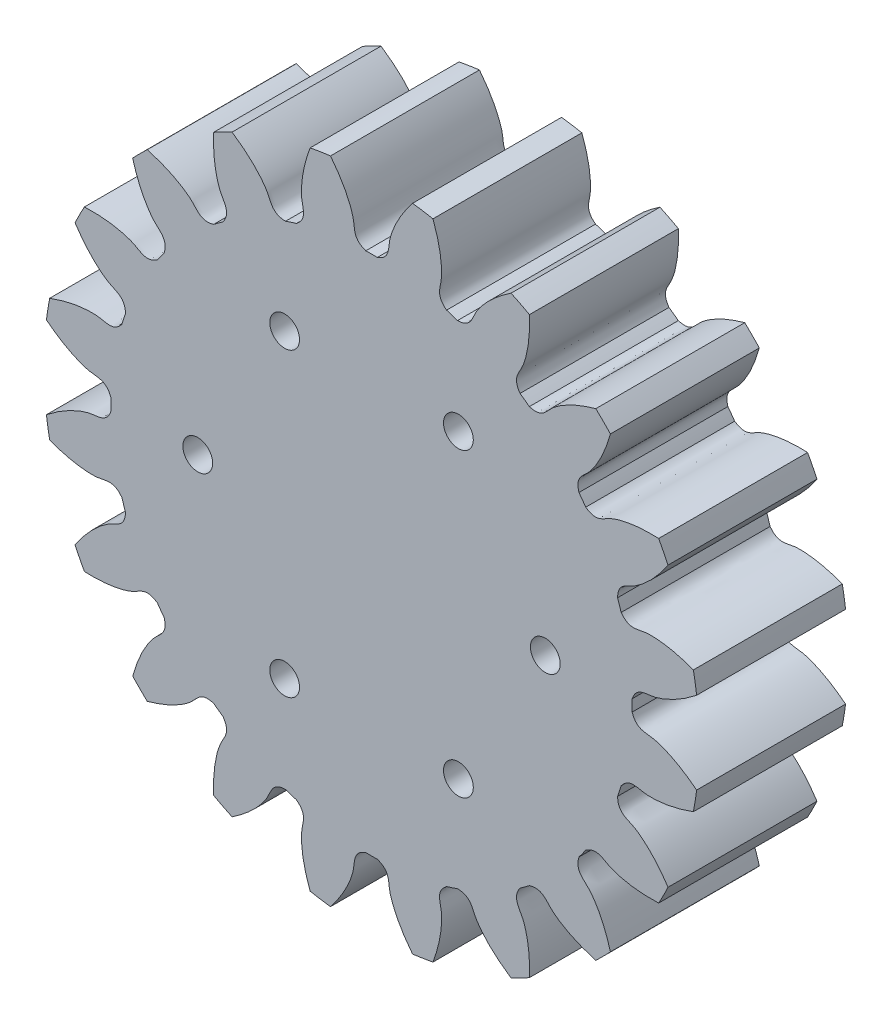
from build123d import *

# Parameters (mm, degrees)
SKETCH_1_R               = 66
EXTRUDE_1_DEPTH          = 30
CUT_EXTRUDE_1_DEPTH      = 99.04080783
PATTERN_CIRCULAR_1_COUNT = 20
SKETCH_4_R               = 3
CUT_EXTRUDE_3_DEPTH      = 100


with BuildPart() as part:
    # 草图1 → 凸台-拉伸1 (new body)
    with BuildSketch(Plane.XY):
        Circle(SKETCH_1_R)
    extrude(amount=EXTRUDE_1_DEPTH)

    # 草图2 → 切除-拉伸1 (cut, through all)
    with BuildSketch(Plane.XY):
        with BuildLine():
            ThreePointArc((1.159899603, 52.487185416), (0, 52.5), (-1.159899603, 52.487185416))
            add(Edge.make_bspline(
                [(-1.159899603, 52.487185416), (-3.667136429, 53.360853072), (-3.342504596, 55.122682193), (-3.677382338, 56.820056415), (-3.713353118, 56.985339684), (-3.757865339, 57.171807691), (-3.811752582, 57.379181016), (-3.875874841, 57.607148981), (-3.95107233, 57.855376968), (-4.038179229, 58.123504398), (-4.138018499, 58.411145682), (-4.251402599, 58.717890271), (-4.379132391, 59.043303003), (-4.521996613, 59.386924384), (-4.680771188, 59.748270908), (-4.856218588, 60.126835389), (-5.049087201, 60.522087305), (-5.260110701, 60.933473168), (-5.49000743, 61.360416899), (-5.739479794, 61.802320224), (-6.009213656, 62.258563085), (-6.299877757, 62.728504067), (-6.612123129, 63.211480832), (-6.946582534, 63.706810582), (-7.303869906, 64.213790522), (-7.684579804, 64.731698343), (-8.089286883, 65.259792724), (-8.51854537, 65.797313836), (-8.972888558, 66.343483869), (-9.452828311, 66.897507567), (-9.958854579, 67.458572777), (-10.491434933, 68.02585101), (-11.051014106, 68.598498015), (-11.638013557, 69.175654361), (-12.252831039, 69.756446037), (-12.895840191, 70.339985054), (-13.567390137, 70.925370065), (-14.26780511, 71.511686996), (-14.99738407, 72.098009677), (-15.756400406, 72.68340049), (-16.545101397, 73.266911041), (-17.648841545, 74.049839206), (-18.503594475, 74.617995606), (-19.086947891, 74.989511158)],
                knots=[0, 0, 0, 0, 0.165916003, 0.170905922, 0.176663519, 0.183188797, 0.190481754, 0.198542391, 0.207370708, 0.216966704, 0.22733038, 0.238461736, 0.250360771, 0.263027487, 0.276461881, 0.290663956, 0.30563371, 0.321371144, 0.337876258, 0.355149051, 0.373189524, 0.391997677, 0.411573509, 0.431917021, 0.453028213, 0.474907084, 0.497553636, 0.520967867, 0.545149777, 0.570099367, 0.595816637, 0.622301587, 0.649554216, 0.677574526, 0.706362514, 0.735918183, 0.766241531, 0.797332559, 0.829191267, 0.861817654, 0.895211721, 0.929373468, 1, 1, 1, 1], degree=3))
            ThreePointArc((-19.086947891, 74.989511158), (0, 77.380477922), (19.086947891, 74.989511158))
            add(Edge.make_bspline(
                [(1.159899603, 52.487185416), (3.667136429, 53.360853072), (3.342504596, 55.122682193), (3.677382338, 56.820056415), (3.713353118, 56.985339684), (3.757865339, 57.171807691), (3.811752582, 57.379181016), (3.875874841, 57.607148981), (3.95107233, 57.855376968), (4.038179229, 58.123504398), (4.138018499, 58.411145682), (4.251402599, 58.717890271), (4.379132391, 59.043303003), (4.521996613, 59.386924384), (4.680771188, 59.748270908), (4.856218588, 60.126835389), (5.049087201, 60.522087305), (5.260110701, 60.933473168), (5.49000743, 61.360416899), (5.739479794, 61.802320224), (6.009213656, 62.258563085), (6.299877757, 62.728504067), (6.612123129, 63.211480832), (6.946582534, 63.706810582), (7.303869906, 64.213790522), (7.684579804, 64.731698343), (8.089286883, 65.259792724), (8.51854537, 65.797313836), (8.972888558, 66.343483869), (9.452828311, 66.897507567), (9.958854579, 67.458572777), (10.491434933, 68.02585101), (11.051014106, 68.598498015), (11.638013557, 69.175654361), (12.252831039, 69.756446037), (12.895840191, 70.339985054), (13.567390137, 70.925370065), (14.26780511, 71.511686996), (14.99738407, 72.098009677), (15.756400406, 72.68340049), (16.545101397, 73.266911041), (17.648841545, 74.049839206), (18.503594475, 74.617995606), (19.086947891, 74.989511158)],
                knots=[0, 0, 0, 0, 0.165916003, 0.170905922, 0.176663519, 0.183188797, 0.190481754, 0.198542391, 0.207370708, 0.216966704, 0.22733038, 0.238461736, 0.250360771, 0.263027487, 0.276461881, 0.290663956, 0.30563371, 0.321371144, 0.337876258, 0.355149051, 0.373189524, 0.391997677, 0.411573509, 0.431917021, 0.453028213, 0.474907084, 0.497553636, 0.520967867, 0.545149777, 0.570099367, 0.595816637, 0.622301587, 0.649554216, 0.677574526, 0.706362514, 0.735918183, 0.766241531, 0.797332559, 0.829191267, 0.861817654, 0.895211721, 0.929373468, 1, 1, 1, 1], degree=3))
        make_face()
    cut_extrude_1 = extrude(amount=CUT_EXTRUDE_1_DEPTH, mode=Mode.SUBTRACT)

    # 阵列(圆周)1: 切除-拉伸1 ×20 about axis
    pattern_circular_1_axis = Axis((0, 0, -1.5), (0, 0, 1))
    for i in range(1, PATTERN_CIRCULAR_1_COUNT):
        add(cut_extrude_1.rotate(pattern_circular_1_axis, i * 360 / PATTERN_CIRCULAR_1_COUNT), mode=Mode.SUBTRACT)

    # 草图4 → 切除-拉伸3 (cut)
    with BuildSketch(Plane.XY.offset(30)):
        with Locations((-35, 0)):
            Circle(SKETCH_4_R)
        with Locations((-17.5, 30.310889132)):
            Circle(SKETCH_4_R)
        with Locations((17.5, 30.310889132)):
            Circle(SKETCH_4_R)
        with Locations((35, 0)):
            Circle(SKETCH_4_R)
        with Locations((17.5, -30.310889132)):
            Circle(SKETCH_4_R)
        with Locations((-17.5, -30.310889132)):
            Circle(SKETCH_4_R)
    extrude(amount=-CUT_EXTRUDE_3_DEPTH, mode=Mode.SUBTRACT)


solid = part.part
